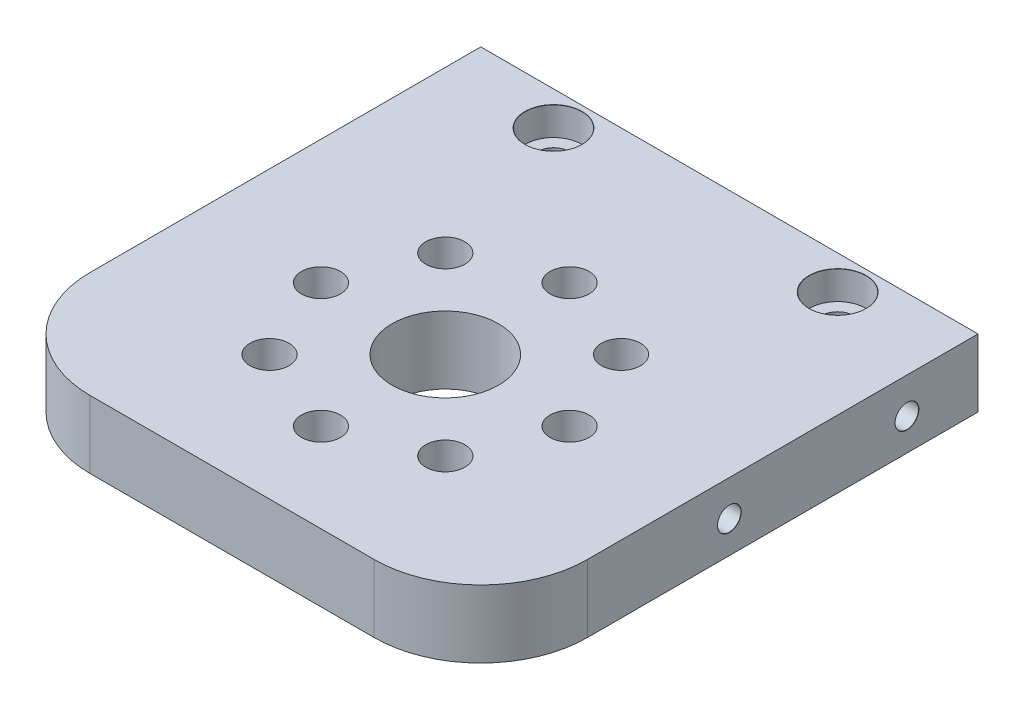
from build123d import *

# Parameters (mm, degrees)
SKETCH1_W                            = 70
SKETCH1_H                            = 70
BOSS_EXTRUDE1_DEPTH                  = 9.525
CBORE_FOR_M5_SHCS2_AT_2_COUNT        = 2
CBORE_FOR_M5_SHCS2_AT_2_PITCH        = 13.393920133
CBORE_FOR_M5_SHCS2_AT_3_COUNT        = 2
CBORE_FOR_M5_SHCS2_AT_3_PITCH        = 24.748737342
CBORE_FOR_M5_SHCS2_AT_4_COUNT        = 2
CBORE_FOR_M5_SHCS2_AT_4_PITCH        = 32.335783638
CBORE_FOR_M5_SHCS2_AT_5_COUNT        = 2
CBORE_FOR_M5_SHCS2_AT_5_PITCH        = 35
CBORE_FOR_M5_SHCS2_AT_6_COUNT        = 2
CBORE_FOR_M5_SHCS2_AT_6_PITCH        = 32.335783638
CBORE_FOR_M5_SHCS2_AT_7_COUNT        = 2
CBORE_FOR_M5_SHCS2_AT_7_PITCH        = 24.748737342
CBORE_FOR_M5_SHCS2_AT_8_COUNT        = 2
CBORE_FOR_M5_SHCS2_AT_8_PITCH        = 13.393920133
TAP_DRILL_FOR_M4X0_7_TAP1_AT_2_COUNT = 2
TAP_DRILL_FOR_M4X0_7_TAP1_AT_2_PITCH = 25
SKETCH9_R                            = 7.5
CUT_EXTRUDE1_DEPTH                   = 51.405611047
CBORE_FOR_M4_SHCS1_AT_2_COUNT        = 2
CBORE_FOR_M4_SHCS1_AT_2_PITCH        = 40
FILLET1_R                            = 15


with BuildPart() as part:
    # Sketch1 → Boss-Extrude1 (new body)
    with BuildSketch(Plane(origin=(0, 0, 0), x_dir=(1, 0, 0), z_dir=(0, 1, 0))):
        Rectangle(SKETCH1_W, SKETCH1_H)
    extrude(amount=BOSS_EXTRUDE1_DEPTH)

    # Sketch4 → CBORE for M5 SHCS2 (revolve, cut)
    with BuildSketch(Plane(origin=(0, 0, 22.5), x_dir=(0, 0, -1), z_dir=(1, 0, 0))):
        Polygon((0, 0), (0, 9.525), (2.75, 9.525), (2.75, 5), (5, 5), (5, 0.025), (5.025, 0), align=None)
    cbore_for_m5_shcs2 = revolve(axis=Axis((0, -6.35, 22.5), (0, 1, 0)), mode=Mode.SUBTRACT)

    # CBORE for M5 SHCS2 at 2: CBORE for M5 SHCS2 ×2
    with Locations(*[Vector(0.9238795325112866, 0, -0.38268343236509006) * (i * CBORE_FOR_M5_SHCS2_AT_2_PITCH) for i in range(1, CBORE_FOR_M5_SHCS2_AT_2_COUNT)]):
        add(cbore_for_m5_shcs2, mode=Mode.SUBTRACT)

    # CBORE for M5 SHCS2 at 3: CBORE for M5 SHCS2 ×2
    with Locations(*[Vector(0.7071067811865475, 0, -0.7071067811865477) * (i * CBORE_FOR_M5_SHCS2_AT_3_PITCH) for i in range(1, CBORE_FOR_M5_SHCS2_AT_3_COUNT)]):
        add(cbore_for_m5_shcs2, mode=Mode.SUBTRACT)

    # CBORE for M5 SHCS2 at 4: CBORE for M5 SHCS2 ×2
    with Locations(*[Vector(0.3826834323650898, 0, -0.9238795325112868) * (i * CBORE_FOR_M5_SHCS2_AT_4_PITCH) for i in range(1, CBORE_FOR_M5_SHCS2_AT_4_COUNT)]):
        add(cbore_for_m5_shcs2, mode=Mode.SUBTRACT)

    # CBORE for M5 SHCS2 at 5: CBORE for M5 SHCS2 ×2
    with Locations(*[(0, 0, -i * CBORE_FOR_M5_SHCS2_AT_5_PITCH) for i in range(1, CBORE_FOR_M5_SHCS2_AT_5_COUNT)]):
        add(cbore_for_m5_shcs2, mode=Mode.SUBTRACT)

    # CBORE for M5 SHCS2 at 6: CBORE for M5 SHCS2 ×2
    with Locations(*[Vector(-0.3826834323650896, 0, -0.9238795325112868) * (i * CBORE_FOR_M5_SHCS2_AT_6_PITCH) for i in range(1, CBORE_FOR_M5_SHCS2_AT_6_COUNT)]):
        add(cbore_for_m5_shcs2, mode=Mode.SUBTRACT)

    # CBORE for M5 SHCS2 at 7: CBORE for M5 SHCS2 ×2
    with Locations(*[Vector(-0.7071067811865474, 0, -0.7071067811865477) * (i * CBORE_FOR_M5_SHCS2_AT_7_PITCH) for i in range(1, CBORE_FOR_M5_SHCS2_AT_7_COUNT)]):
        add(cbore_for_m5_shcs2, mode=Mode.SUBTRACT)

    # CBORE for M5 SHCS2 at 8: CBORE for M5 SHCS2 ×2
    with Locations(*[Vector(-0.9238795325112867, 0, -0.38268343236509) * (i * CBORE_FOR_M5_SHCS2_AT_8_PITCH) for i in range(1, CBORE_FOR_M5_SHCS2_AT_8_COUNT)]):
        add(cbore_for_m5_shcs2, mode=Mode.SUBTRACT)

    # Sketch8 → Tap Drill for M4x0.7 Tap1 (revolve, cut)
    with BuildSketch(Plane(origin=(35, 4.5, 0), x_dir=(0, 0, -1), z_dir=(0, 1, 0))):
        Polygon((0, 0), (0, 8.991420021), (1.65, 8), (1.65, 0.025), (1.675, 0), align=None)
    tap_drill_for_m4x0_7_tap1 = revolve(axis=Axis((41.35, 4.5, 0), (-1, 0, 0)), mode=Mode.SUBTRACT)

    # Tap Drill for M4x0.7 Tap1 at 2: Tap Drill for M4x0.7 Tap1 ×2
    with Locations(*[(0, 0, -i * TAP_DRILL_FOR_M4X0_7_TAP1_AT_2_PITCH) for i in range(1, TAP_DRILL_FOR_M4X0_7_TAP1_AT_2_COUNT)]):
        add(tap_drill_for_m4x0_7_tap1, mode=Mode.SUBTRACT)

    # Sketch9 → Cut-Extrude1 (cut, through all)
    with BuildSketch(Plane.XZ):
        with Locations((0, 5)):
            Circle(SKETCH9_R)
    extrude(amount=-CUT_EXTRUDE1_DEPTH, mode=Mode.SUBTRACT)

    # Sketch15 → CBORE for M4 SHCS1 (revolve, cut)
    with BuildSketch(Plane(origin=(-20, 9.525, -30.2375), x_dir=(0, 0, 1), z_dir=(1, 0, 0))):
        Polygon((0, 0), (0, 9.525), (2.25, 9.525), (2.25, 4), (4, 4), (4, 0.025), (4.025, 0), align=None)
    cbore_for_m4_shcs1 = revolve(axis=Axis((-20, 15.875, -30.2375), (0, -1, 0)), mode=Mode.SUBTRACT)

    # CBORE for M4 SHCS1 at 2: CBORE for M4 SHCS1 ×2
    with Locations(*[(i * CBORE_FOR_M4_SHCS1_AT_2_PITCH, 0, 0) for i in range(1, CBORE_FOR_M4_SHCS1_AT_2_COUNT)]):
        add(cbore_for_m4_shcs1, mode=Mode.SUBTRACT)

    # Mirror1: Tap Drill for M4x0.7 Tap1 across plane
    add(tap_drill_for_m4x0_7_tap1.mirror(Plane(origin=(0, 0, 0), x_dir=(0, 0, 1), z_dir=(1, 0, 0))), mode=Mode.SUBTRACT)

    # Mirror1 copy 1 sketch → Mirror1 copy 1 (revolve, cut)
    with BuildSketch(Plane(origin=(-35, 4.5, -25), x_dir=(0, 0, -1), z_dir=(0, 1, 0))):
        Polygon((0, 0), (0, -8.991420021), (1.65, -8), (1.65, -0.025), (1.675, 0), align=None)
    revolve(axis=Axis((-41.35, 4.5, -25), (-1, 0, 0)), mode=Mode.SUBTRACT)

    # Fillet1
    fillet1_edges = [part.edges().sort_by_distance(p)[0] for p in [
        (-35, 4.7625, 35),
        (35, 4.7625, 35),
    ]]
    fillet(fillet1_edges, radius=FILLET1_R)


solid = part.part
